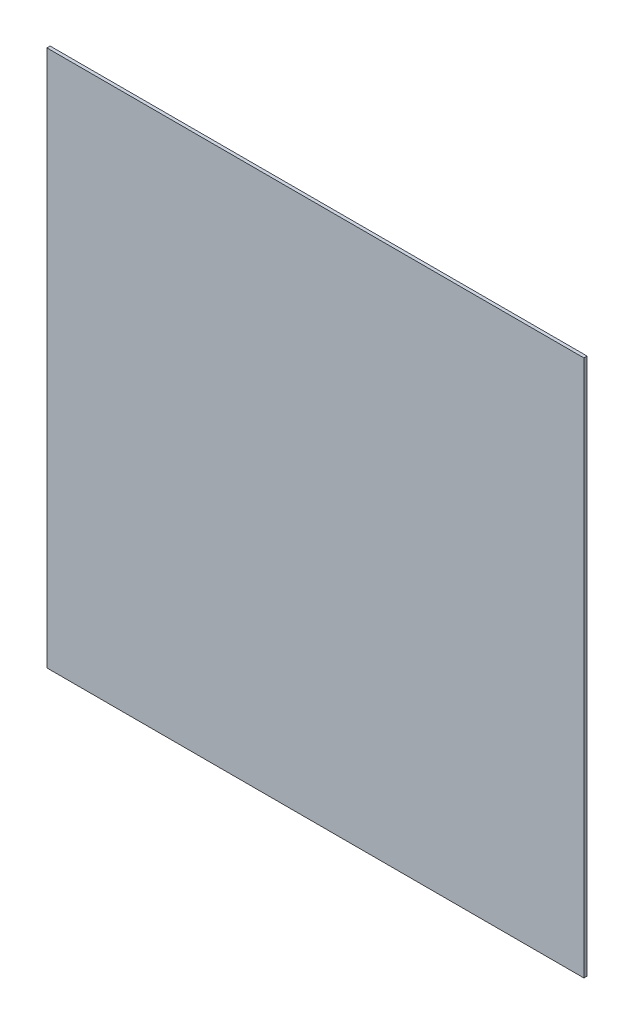
from build123d import *

# Parameters (mm, degrees)
SKETCH_1_W      = 500
SKETCH_1_H      = 500
EXTRUDE_1_DEPTH = 3


with BuildPart() as part:
    # 草图1 → 凸台-拉伸1 (new body)
    with BuildSketch(Plane.XY):
        Rectangle(SKETCH_1_W, SKETCH_1_H)
    extrude(amount=EXTRUDE_1_DEPTH)


solid = part.part
